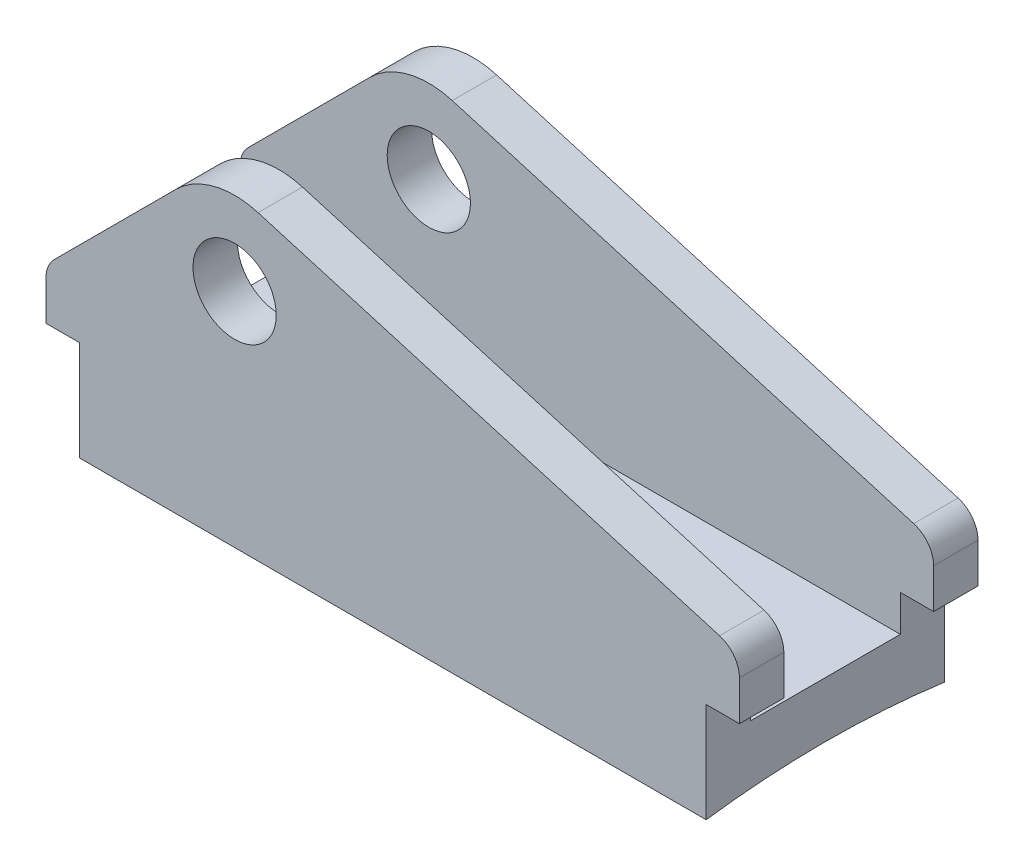
from build123d import *

# Parameters (mm, degrees)
SKETCH2_R           = 7.5
BOSS_EXTRUDE1_DEPTH = 21.5
SKETCH1_W           = 13.5
SKETCH1_H           = 90
CUT_EXTRUDE2_DEPTH  = 63


with BuildPart() as part:
    # Sketch2 → Boss-Extrude1 (new, symmetric)
    with BuildSketch(Plane.XY):
        with BuildLine():
            Line((-56.5, 158.548888359), (56.5, 158.548888359))
            Line((56.5, 158.548888359), (56.5, 176.548888359))
            Line((56.5, 176.548888359), (62.5, 176.548888359))
            Line((62.5, 176.548888359), (62.5, 183.691023983))
            ThreePointArc((62.5, 183.691023983), (61.503173004, 186.686788643), (58.91015764, 188.488049669))
            Line((58.91015764, 188.488049669), (-24.26952708, 212.939965417))
            ThreePointArc((-24.26952708, 212.939965417), (-32.207333005, 213.083525678), (-39.106601718, 209.155490077))
            Line((-39.106601718, 209.155490077), (-61.035533906, 187.226557889))
            ThreePointArc((-61.035533906, 187.226557889), (-62.119397663, 185.604441145), (-62.5, 183.691023983))
            Line((-62.5, 183.691023983), (-62.5, 176.548888359))
            Line((-62.5, 176.548888359), (-56.5, 176.548888359))
            Line((-56.5, 176.548888359), (-56.5, 158.548888359))
        make_face()
        with Locations((-28.5, 198.548888359)):
            Circle(SKETCH2_R, mode=Mode.SUBTRACT)
    extrude(amount=BOSS_EXTRUDE1_DEPTH, both=True)

    # Sketch1 → Cut-Extrude2 (cut, symmetric)
    with BuildSketch(Plane(origin=(0, 0, 0), x_dir=(0, 0, -1), z_dir=(1, 0, 0))):
        with BuildLine():
            ThreePointArc((21.5, 158.548888359), (10.774457353, 159.63680988), (0, 160))
            ThreePointArc((0, 160), (-10.774457353, 159.63680988), (-21.5, 158.548888359))
            Line((-21.5, 158.548888359), (21.5, 158.548888359))
        make_face()
        with BuildLine():
            ThreePointArc((160, 0), (120.498962651, 105.261578936), (21.5, 158.548888359))
            Line((21.5, 158.548888359), (-21.5, 158.548888359))
            ThreePointArc((-21.5, 158.548888359), (-105.261578936, -120.498962651), (160, 0))
        make_face()
        with Locations((6.75, 215)):
            Rectangle(SKETCH1_W, SKETCH1_H)
        with Locations((-6.75, 215)):
            Rectangle(SKETCH1_W, SKETCH1_H)
    extrude(amount=CUT_EXTRUDE2_DEPTH, both=True, mode=Mode.SUBTRACT)


solid = part.part
